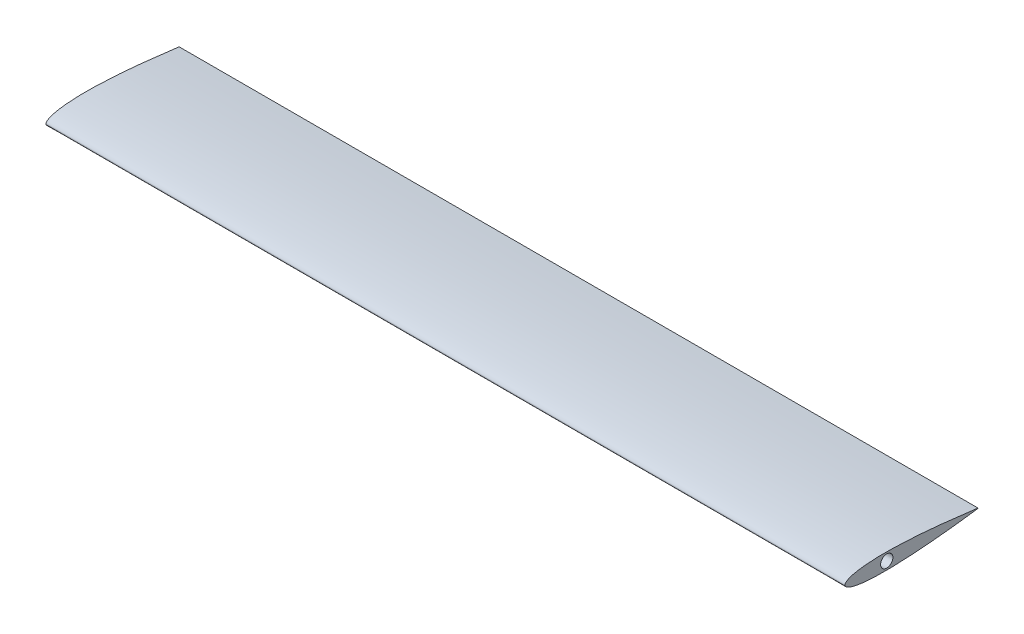
from build123d import *

# Parameters (mm, degrees)
BOSS_EXTRUDE1_DEPTH = 750
SKETCH3_R           = 5.75
CUT_EXTRUDE1_DEPTH  = 804


with BuildPart() as part:
    # Sketch1 → Boss-Extrude1 (new body)
    with BuildSketch(Plane(origin=(0, 0, 0), x_dir=(0, 0, -1), z_dir=(1, 0, 0))):
        with BuildLine():
            Line((124.995841149, 7.69748541), (124.995841149, 7.355117962))
            add(Edge.make_bspline(
                [(124.995841149, 7.69748541), (121.54944134, 8.132970798), (115.70786567, 8.871109432), (106.612829463, 10.001168496), (98.776677449, 10.90008096), (91.010430983, 11.718079743), (84.466171166, 12.374421583), (77.123127033, 13.01089191), (70.096902966, 13.661558661), (63.232186969, 14.038262432), (56.951183357, 14.458646485), (50.183054312, 14.744779284), (43.713149432, 14.928847728), (38.016747366, 14.98676945), (31.867108518, 14.964167357), (25.961108401, 14.764171889), (20.418478368, 14.31892281), (16.080893919, 13.902077279), (11.948417441, 13.276680513), (7.872022134, 12.438747868), (4.55145991, 11.481590763), (1.935078283, 10.189615691), (0.419790589, 8.867752598), (-0.116328202, 7.676448045), (0.228543289, 6.575716308), (1.092059769, 5.382828043), (3.121329832, 4.182675807), (5.833945868, 3.122360161), (8.969424846, 2.338039739), (12.454934448, 1.635555066), (16.398041291, 1.057622245), (20.40737347, 0.619305342), (24.940496845, 0.318514105), (28.9969109, 0.097914693), (33.640357675, 0.064950819), (37.619824838, -0.008774002), (42.130231161, 0.0151669), (46.825478609, 0.12809962), (52.059229259, 0.308197083), (57.570273171, 0.566048003), (63.06655694, 0.903534981), (68.78158744, 1.273560104), (74.2410514, 1.701195853), (79.332078991, 2.13196813), (83.765135248, 2.525837795), (88.333862548, 3.014972175), (93.451881908, 3.495491212), (98.448514928, 4.030663182), (103.359945306, 4.559670893), (107.534749069, 5.051051401), (112.036034411, 5.652589328), (116.898948088, 6.205114514), (121.185254011, 6.89818955), (124.034905271, 7.135577505), (124.871587069, 7.326730223), (124.995841149, 7.355117962)],
                knots=[0, 0, 0, 0, 0.040909693, 0.069341075, 0.107932085, 0.133795715, 0.161307297, 0.185385504, 0.220597866, 0.244393633, 0.266343568, 0.294730889, 0.324163188, 0.342565083, 0.361815516, 0.396586444, 0.412117028, 0.427295281, 0.44789639, 0.461301181, 0.476284913, 0.488528163, 0.495261637, 0.499815717, 0.502760785, 0.508369898, 0.516837026, 0.529992215, 0.542688859, 0.55481219, 0.571870003, 0.589595674, 0.60229618, 0.625369139, 0.637420541, 0.65697654, 0.672241267, 0.69053398, 0.712285021, 0.733912638, 0.755503976, 0.777133729, 0.801356586, 0.819993044, 0.837303591, 0.853766864, 0.874103184, 0.897840615, 0.912945775, 0.932278219, 0.947341947, 0.966428856, 0.989896213, 0.998499505, 1, 1, 1, 1], degree=3))
        make_face()
    extrude(amount=BOSS_EXTRUDE1_DEPTH)

    # Sketch3 → Cut-Extrude1 (cut)
    with BuildSketch(Plane.ZY):
        with Locations((-39.320255878, 7.486804595)):
            Circle(SKETCH3_R)
    extrude(amount=-CUT_EXTRUDE1_DEPTH, mode=Mode.SUBTRACT)


solid = part.part
